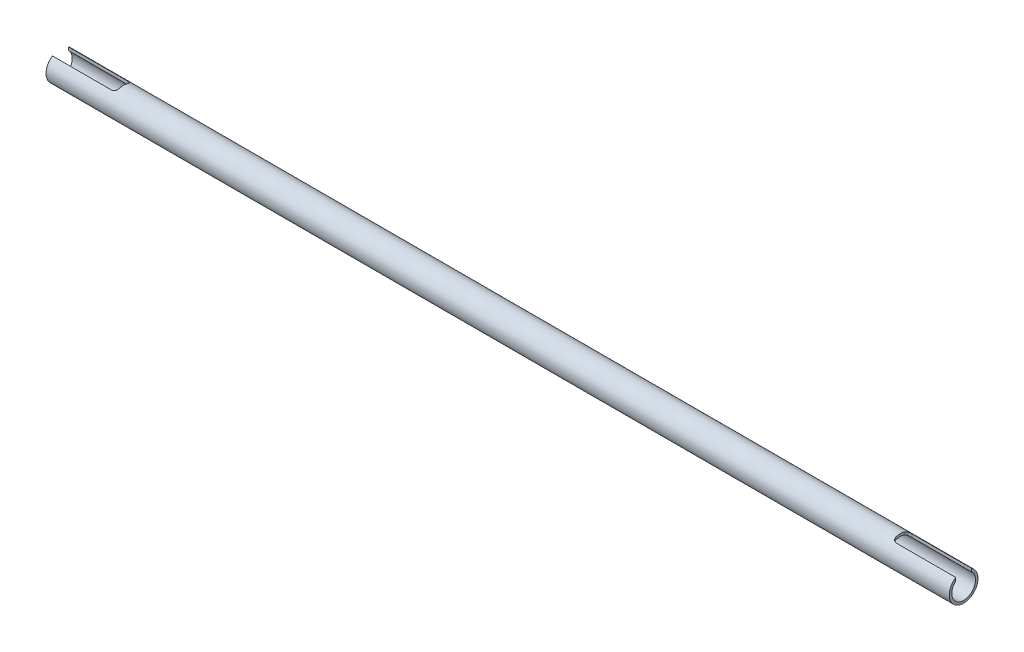
from build123d import *

# Parameters (mm, degrees)
SKETCH1_R           = 11.525
SKETCH1_R_2         = 9.525
EXTRUDE_THIN1_DEPTH = 362.5
CUT_EXTRUDE1_DEPTH  = 23


with BuildPart() as part:
    # Sketch1 → Extrude-Thin1 (new, symmetric)
    with BuildSketch(Plane(origin=(0, 0, 0), x_dir=(0, 0, -1), z_dir=(1, 0, 0))):
        Circle(SKETCH1_R)
        Circle(SKETCH1_R_2, mode=Mode.SUBTRACT)
    extrude(amount=EXTRUDE_THIN1_DEPTH, both=True)

    # Sketch2 → Cut-Extrude1 (cut)
    with BuildSketch(Plane(origin=(0, 0, 0), x_dir=(1, 0, 0), z_dir=(0, 1, 0))):
        with BuildLine():
            Line((314.7, -6.35), (362.5, -6.35))
            Line((362.5, -6.35), (362.5, 6.35))
            Line((362.5, 6.35), (314.7, 6.35))
            ThreePointArc((314.7, 6.35), (312.578679656, 5.471320344), (311.7, 3.35))
            Line((311.7, 3.35), (311.7, -3.35))
            ThreePointArc((311.7, -3.35), (312.578679656, -5.471320344), (314.7, -6.35))
        make_face()
    cut_extrude1 = extrude(amount=CUT_EXTRUDE1_DEPTH, mode=Mode.SUBTRACT)

    # Mirror1: Cut-Extrude1 across plane
    add(cut_extrude1.mirror(Plane(origin=(0, 0, 0), x_dir=(0, 0, 1), z_dir=(1, 0, 0))), mode=Mode.SUBTRACT)


solid = part.part
